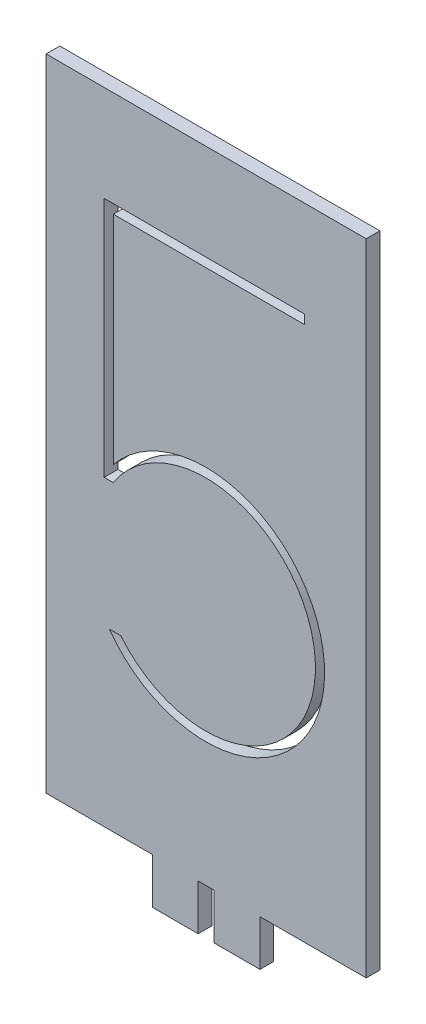
from build123d import *

# Parameters (mm, degrees)
SKIZZE1_W                       = 35
SKIZZE1_H                       = 75
AUFSATZ_LINEAR_AUSTRAGEN1_DEPTH = 1.5
SKIZZE2_W                       = 11.63
SKIZZE2_H                       = 5
SKIZZE2_W_2                     = 11.62
SKIZZE2_W_3                     = 1.75
SCHNITT_LINEAR_AUSTRAGEN1_DEPTH = 1.5
SCHNITT_LINEAR_AUSTRAGEN5_DEPTH = 20
SCHNITT_LINEAR_AUSTRAGEN6_DEPTH = 20


with BuildPart() as part:
    # Skizze1 → Aufsatz-Linear austragen1 (new body)
    with BuildSketch(Plane.XY):
        with Locations((17.5, 37.5)):
            Rectangle(SKIZZE1_W, SKIZZE1_H)
    extrude(amount=AUFSATZ_LINEAR_AUSTRAGEN1_DEPTH)

    # Skizze2 → Schnitt-Linear austragen1 (cut)
    with BuildSketch(Plane.XY.offset(1.5)):
        with Locations((5.815, 2.5)):
            Rectangle(SKIZZE2_W, SKIZZE2_H)
        with Locations((29.19, 2.5)):
            Rectangle(SKIZZE2_W_2, SKIZZE2_H)
        with Locations((17.505, 2.5)):
            Rectangle(SKIZZE2_W_3, SKIZZE2_H)
    extrude(amount=-SCHNITT_LINEAR_AUSTRAGEN1_DEPTH, mode=Mode.SUBTRACT)

    # Skizze10 → Schnitt-Linear austragen5 (cut)
    with BuildSketch(Plane.XY.offset(1.5)):
        with BuildLine():
            Line((7.35039959, 38.082998074), (6.35039959, 38.370002144))
            ThreePointArc((6.35039959, 38.370002144), (30.439070096, 32.099486097), (6.902625657, 23.998918129))
            Line((6.902625657, 23.998918129), (8.1632503, 23.998918129))
            ThreePointArc((8.1632503, 23.998918129), (29.428721451, 32.291733198), (7.35039959, 38.082998074))
        make_face()
    extrude(amount=-SCHNITT_LINEAR_AUSTRAGEN5_DEPTH, mode=Mode.SUBTRACT)

    # Skizze11 → Schnitt-Linear austragen6 (cut)
    with BuildSketch(Plane.XY.offset(1.5)):
        Polygon((7.35039959, 38.082998074), (6.35039959, 38.082998074), (6.35039959, 64.5), (7.35039959, 64.5), (28.25, 64.5), (28.25, 63.5), (7.35039959, 63.5), align=None)
    extrude(amount=-SCHNITT_LINEAR_AUSTRAGEN6_DEPTH, mode=Mode.SUBTRACT)


solid = part.part
